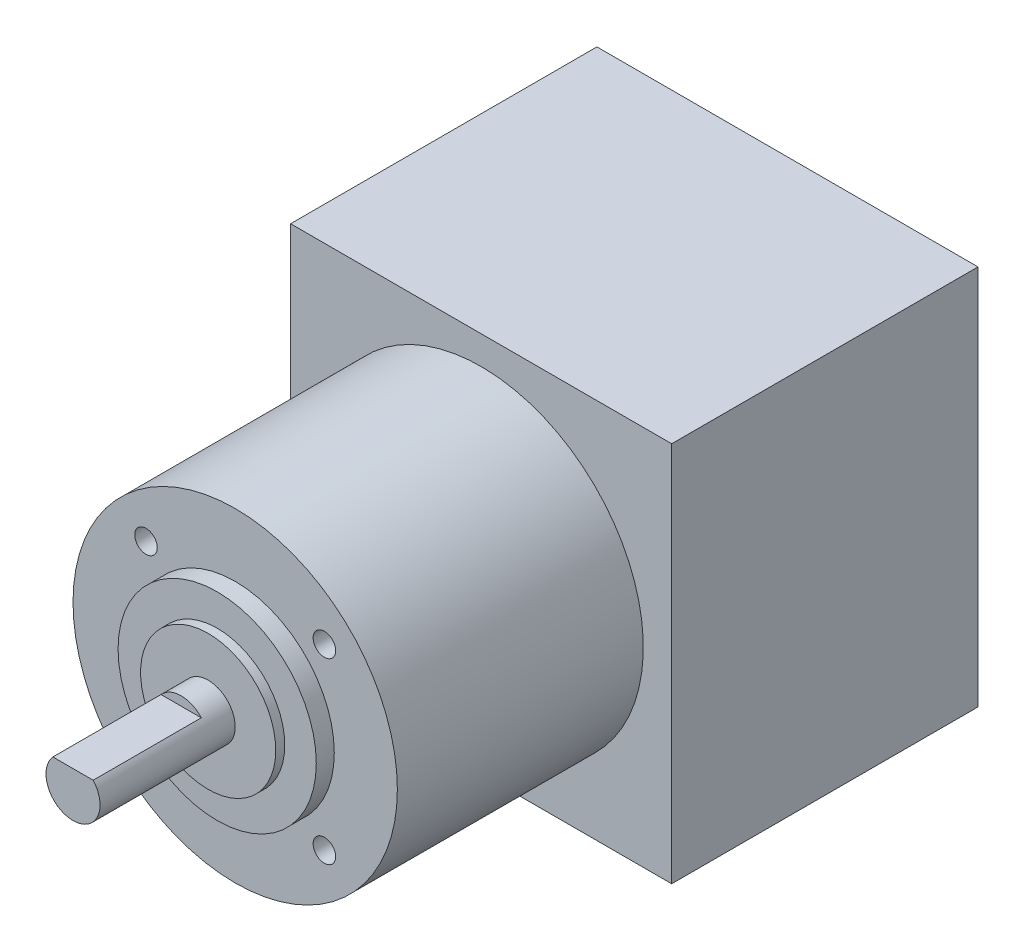
from build123d import *

# Parameters (mm, degrees)
SKIZZE1_W                       = 42.3
SKIZZE1_H                       = 42.3
AUFSATZ_LINEAR_AUSTRAGEN1_DEPTH = 34
SKIZZE2_R                       = 18
AUFSATZ_LINEAR_AUSTRAGEN2_DEPTH = 27.3
SKIZZE3_R                       = 11
AUFSATZ_LINEAR_AUSTRAGEN3_DEPTH = 2
SKIZZE4_R                       = 7.5
AUFSATZ_LINEAR_AUSTRAGEN4_DEPTH = 1
SKIZZE5_R                       = 3
AUFSATZ_LINEAR_AUSTRAGEN5_DEPTH = 15
SCHNITT_LINEAR_START            = -12
SCHNITT_LINEAR_AUSTRAGEN1_DEPTH = 12
M3_GEWINDEBOHRUNG1_D            = 2.5
M3_GEWINDEBOHRUNG1_DEPTH        = 8.5
M3_GEWINDEBOHRUNG1_TIP          = 0.751075774
SKIZZE9_R                       = 5.5
AUFSATZ_LINEAR_AUSTRAGEN6_DEPTH = 5


with BuildPart() as part:
    # Skizze1 → Aufsatz-Linear austragen1 (new body)
    with BuildSketch(Plane.XY):
        with Locations((21.15, 21.15)):
            Rectangle(SKIZZE1_W, SKIZZE1_H)
    extrude(amount=AUFSATZ_LINEAR_AUSTRAGEN1_DEPTH)

    # Skizze2 → Aufsatz-Linear austragen2 (add)
    with BuildSketch(Plane.XY.offset(34)):
        with Locations(Location((21.15, 21.15, 0), (0, 0, 180))):
            Circle(SKIZZE2_R)
    extrude(amount=AUFSATZ_LINEAR_AUSTRAGEN2_DEPTH)

    # Skizze3 → Aufsatz-Linear austragen3 (add)
    with BuildSketch(Plane.XY.offset(61.3)):
        with Locations((21.15, 21.15)):
            Circle(SKIZZE3_R)
    extrude(amount=AUFSATZ_LINEAR_AUSTRAGEN3_DEPTH)

    # Skizze4 → Aufsatz-Linear austragen4 (add)
    with BuildSketch(Plane.XY.offset(63.3)):
        with Locations((21.15, 21.15)):
            Circle(SKIZZE4_R)
    extrude(amount=AUFSATZ_LINEAR_AUSTRAGEN4_DEPTH)

    # Skizze5 → Aufsatz-Linear austragen5 (add)
    with BuildSketch(Plane.XY.offset(64.3)):
        with Locations((21.15, 21.15)):
            Circle(SKIZZE5_R)
    extrude(amount=AUFSATZ_LINEAR_AUSTRAGEN5_DEPTH)

    # Skizze6 → Schnitt-Linear austragen1 (cut)
    with BuildSketch(Plane.XY.offset(79.3).offset(SCHNITT_LINEAR_START)):
        with BuildLine():
            Line((23.386067977, 23.15), (18.913932023, 23.15))
            ThreePointArc((18.913932023, 23.15), (21.15, 24.15), (23.386067977, 23.15))
        make_face()
    extrude(amount=SCHNITT_LINEAR_AUSTRAGEN1_DEPTH, mode=Mode.SUBTRACT)

    # M3 Gewindebohrung1
    with Locations(Plane.XY.offset(61.3)):
        with Locations((11.250505063, 11.250505063), (31.049494937, 11.250505063), (31.049494937, 31.049494937), (11.250505063, 31.049494937)):
            Hole(M3_GEWINDEBOHRUNG1_D / 2, depth=M3_GEWINDEBOHRUNG1_DEPTH)
            with Locations((0, 0, -(M3_GEWINDEBOHRUNG1_DEPTH + M3_GEWINDEBOHRUNG1_TIP / 2))):  # 118° drill point
                Cone(0, M3_GEWINDEBOHRUNG1_D / 2, M3_GEWINDEBOHRUNG1_TIP, mode=Mode.SUBTRACT)

    # Skizze9 → Aufsatz-Linear austragen6 (add)
    with BuildSketch(Plane(origin=(0, 0, 0), x_dir=(-1, 0, 0), z_dir=(0, -1, 0))):
        with Locations(Location((-21.15, -10, 0), (0, 0, 270))):
            Circle(SKIZZE9_R)
    extrude(amount=AUFSATZ_LINEAR_AUSTRAGEN6_DEPTH)


solid = part.part
